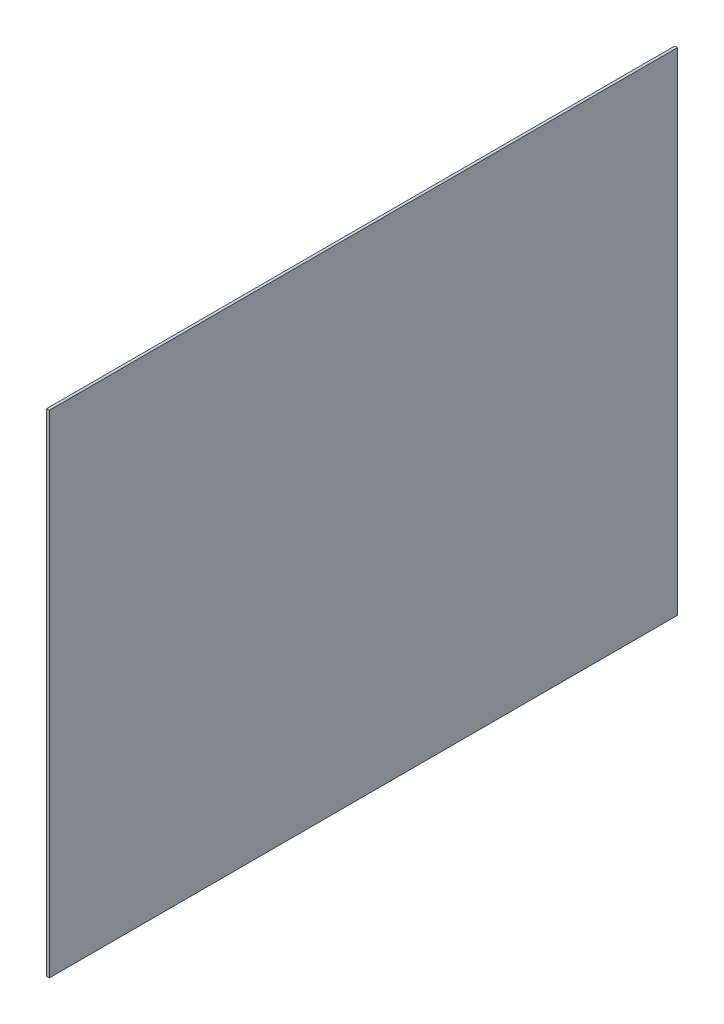
from build123d import *

# Parameters (mm, degrees)
SKETCH1_W           = 690
SKETCH1_H           = 540
BOSS_EXTRUDE1_DEPTH = 3


with BuildPart() as part:
    # Sketch1 → Boss-Extrude1 (new body)
    with BuildSketch(Plane(origin=(0, 0, 0), x_dir=(0, 0, -1), z_dir=(1, 0, 0))):
        Rectangle(SKETCH1_W, SKETCH1_H)
    extrude(amount=BOSS_EXTRUDE1_DEPTH)


solid = part.part
